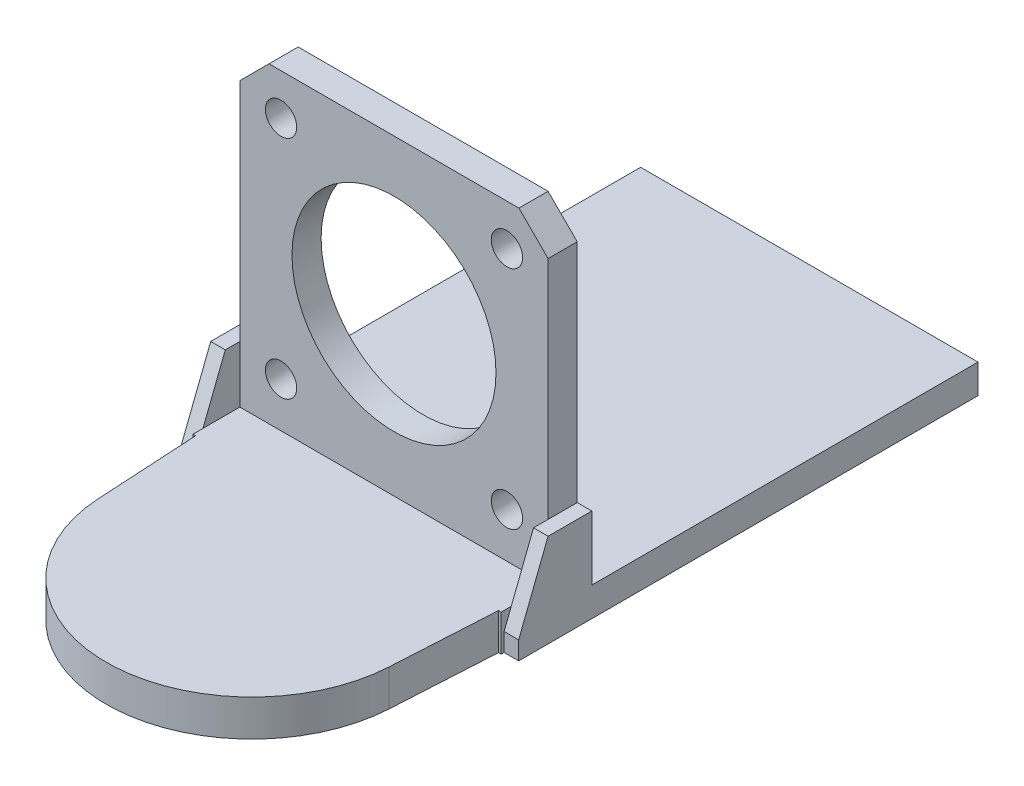
from build123d import *

# Parameters (mm, degrees)
SKETCH_5_W                = 42.3
SKETCH_5_H                = 50.3
SKETCH_5_R                = 11.15
SKETCH_5_R_2              = 2.15
EXTRUDE_2_DEPTH           = 4
EXTRUDE_3_DEPTH           = 4
SKETCH_7_R                = 1.7
CUT_EXTRUDE_3_DEPTH       = 4
CHAMFER_1_SIZE            = 4
EXTRUDE_4_DEPTH           = 2
EXTRUDE_5_REACH           = 79.8
EXTRUDE_6_REACH           = 80.956
SKETCH_12_W               = 46.3
SKETCH_12_H               = 3
EXTRUDE_7_DEPTH           = 53
EXTRUDE_9_DEPTH           = 4
CUT_EXTRUDE_4_DEPTH       = 5
SKETCH_17_R               = 5.175
EXTRUDE_10_DEPTH          = 15
SKETCH_18_R               = 1.6
CUT_EXTRUDE_6_DEPTH       = 15
F_2_0MM_1_D               = 3.1
F_2_0MM_1_DEPTH           = 4.45
F_2_0MM_1_TIP             = 1.55
F_2_0MM_1_ON_FACE_2_D     = 3.1
F_2_0MM_1_ON_FACE_2_DEPTH = 4.45
F_2_0MM_1_ON_FACE_2_TIP   = 1.55
F_2_0MM_1_ON_FACE_3_D     = 3.1
F_2_0MM_1_ON_FACE_3_DEPTH = 4.45
F_2_0MM_1_ON_FACE_3_TIP   = 1.55
SKETCH_21_W               = 46.3
SKETCH_21_H               = 53
CUT_EXTRUDE_7_DEPTH       = 1.5
CUT_EXTRUDE_START         = -0.5
CUT_EXTRUDE_8_DEPTH       = 0.5
EXTRUDE_START             = 2.5
EXTRUDE_11_DEPTH          = 2.5
SKETCH_25_R               = 2.55
CUT_EXTRUDE_9_DEPTH       = 15
SKETCH_28_R               = 5.175
EXTRUDE_13_DEPTH          = 3.5
EXTRUDE_START_2           = -17
SKETCH_30_R               = 5.175
EXTRUDE_15_DEPTH          = 17
SKETCH_31_R               = 8.175
EXTRUDE_16_DEPTH          = 13
SKETCH_32_R               = 2.5
CUT_EXTRUDE_10_DEPTH      = 18
CUT_EXTRUDE_START_2       = -1.5
SKETCH_33_R               = 8.175
CUT_EXTRUDE_11_DEPTH      = 1.5
F_3_0MM_1_D               = 3
F_3_0MM_1_DEPTH           = 5.5
F_3_0MM_1_TIP             = 1.5
F_3_0MM_1_ON_FACE_2_D     = 3
F_3_0MM_1_ON_FACE_2_DEPTH = 5.5
F_3_0MM_1_ON_FACE_2_TIP   = 1.5
F_3_0MM_1_ON_FACE_3_D     = 3
F_3_0MM_1_ON_FACE_3_DEPTH = 5.5
F_3_0MM_1_ON_FACE_3_TIP   = 1.5
SKETCH_36_R               = 14
CUT_EXTRUDE_12_DEPTH      = 5


with BuildPart() as part:
    # 草图5 → 凸台-拉伸2 (new body)
    with BuildSketch(Plane.XY):
        with Locations((0, 25.15)):
            Rectangle(SKETCH_5_W, SKETCH_5_H)
        with Locations((0, 29.15)):
            Circle(SKETCH_5_R, mode=Mode.SUBTRACT)
        with Locations((15.5, 44.65)):
            Circle(SKETCH_5_R_2, mode=Mode.SUBTRACT)
        with Locations((15.5, 13.65)):
            Circle(SKETCH_5_R_2, mode=Mode.SUBTRACT)
        with Locations((-15.5, 13.65)):
            Circle(SKETCH_5_R_2, mode=Mode.SUBTRACT)
        with Locations((-15.5, 44.65)):
            Circle(SKETCH_5_R_2, mode=Mode.SUBTRACT)
    extrude(amount=-EXTRUDE_2_DEPTH)

    # 草图6 → 凸台-拉伸3 (add)
    with BuildSketch(Plane.XZ):
        with BuildLine():
            Line((-21.15, 0), (-19.967256346, 20.643972909))
            ThreePointArc((-19.967256346, 20.643972909), (0, 39.5), (19.967256346, 20.643972909))
            Line((19.967256346, 20.643972909), (21.15, 0))
            Line((21.15, 0), (-21.15, 0))
        make_face()
    extrude(amount=-EXTRUDE_3_DEPTH)

    # 草图7 → 切除-拉伸3 (cut)
    with BuildSketch(Plane(origin=(0, 4, 0), x_dir=(1, 0, 0), z_dir=(0, 1, 0))):
        with Locations((0, -5.5)):
            Circle(SKETCH_7_R)
        with Locations((12.124355653, -12.5)):
            Circle(SKETCH_7_R)
        with Locations((12.124355653, -26.5)):
            Circle(SKETCH_7_R)
        with Locations((0, -33.5)):
            Circle(SKETCH_7_R)
        with Locations((-12.124355653, -26.5)):
            Circle(SKETCH_7_R)
        with Locations((-12.124355653, -12.5)):
            Circle(SKETCH_7_R)
    extrude(amount=-CUT_EXTRUDE_3_DEPTH, mode=Mode.SUBTRACT)

    # 倒角1
    chamfer_1_edges = [part.edges().sort_by_distance(p)[0] for p in [
        (21.15, 50.3, -2),
        (-21.15, 50.3, -2),
    ]]
    chamfer(chamfer_1_edges, length=CHAMFER_1_SIZE)

    # 草图9 → 凸台-拉伸4 (add)
    with BuildSketch(Plane.ZY.offset(21.15)):
        Polygon((-4, 0), (8, 0), (2, 15.3), (-4, 15.3), align=None)
    extrude_4 = extrude(amount=EXTRUDE_4_DEPTH)

    # 凸台-拉伸5: up to this plane
    extrude_5_end = Plane(origin=(-21.15, 4, 0), z_dir=(-0.9983628172970396, 0, 0.05719864542730192))
    # 草图10 → 凸台-拉伸5 (add, up to the surface)
    with BuildSketch(Plane.ZY.offset(23.15), mode=Mode.PRIVATE) as extrude_5_sk1:
        Polygon((-4, 0), (8, 0), (6.431372549, 4), (-4, 4), align=None)
    extrude_5_tool1 = split(extrude(extrude_5_sk1.sketch, amount=-EXTRUDE_5_REACH, mode=Mode.PRIVATE), bisect_by=extrude_5_end, keep=Keep.BOTH, mode=Mode.PRIVATE)
    add(extrude_5_tool1.solids().sort_by_distance((-23.15, 1.95338, 1.616984))[0])

    # 镜向2: 凸台-拉伸4 across plane
    add(extrude_4.mirror(Plane(origin=(0, 0, 0), x_dir=(0, 0, 1), z_dir=(1, 0, 0))))

    # 凸台-拉伸6: up to this plane
    extrude_6_end = Plane(origin=(21.15, 4, 0), z_dir=(0.9983628172970396, 0, 0.05719864542730192))
    # 草图11 → 凸台-拉伸6 (add, up to the surface)
    with BuildSketch(Plane(origin=(23.15, 0, 0), x_dir=(0, 0, -1), z_dir=(1, 0, 0)), mode=Mode.PRIVATE) as extrude_6_sk1:
        Polygon((-6.431372549, 4), (4, 4), (4, 0), (-8, 0), align=None)
    extrude_6_tool1 = split(extrude(extrude_6_sk1.sketch, amount=-EXTRUDE_6_REACH, mode=Mode.PRIVATE), bisect_by=extrude_6_end, keep=Keep.BOTH, mode=Mode.PRIVATE)
    add(extrude_6_tool1.solids().sort_by_distance((23.15, 1.95338, 1.616984))[0])

    # 草图12 → 凸台-拉伸7 (add)
    with BuildSketch(Plane(origin=(0, 0, -4), x_dir=(-1, 0, 0), z_dir=(0, 0, -1))):
        with Locations((0, 6.5)):
            Rectangle(SKETCH_12_W, SKETCH_12_H)
    extrude(amount=EXTRUDE_7_DEPTH)

    # 草图14 → 凸台-拉伸9 (add)
    with BuildSketch(Plane(origin=(0, 4, 0), x_dir=(1, 0, 0), z_dir=(0, 1, 0))):
        with BuildLine():
            Line((21.15, 0), (-21.15, 0))
            Line((-21.15, 0), (-21.15, -6.431372549))
            Line((-21.15, -6.431372549), (-20.781530951, -6.431372549))
            Line((-20.781530951, -6.431372549), (-19.967256346, -20.643972909))
            ThreePointArc((-19.967256346, -20.643972909), (0, -39.5), (19.967256346, -20.643972909))
            Line((19.967256346, -20.643972909), (20.781530951, -6.431372549))
            Line((20.781530951, -6.431372549), (21.15, -6.431372549))
            Line((21.15, -6.431372549), (21.15, 0))
        make_face()
    extrude(amount=EXTRUDE_9_DEPTH)

    # 草图15 → 切除-拉伸4 (cut)
    with BuildSketch(Plane.XZ):
        with BuildLine():
            Line((-23.15, -4), (23.15, -4))
            Line((23.15, -4), (23.15, 8))
            Line((23.15, 8), (20.691660451, 8))
            Line((20.691660451, 8), (19.967256346, 20.643972909))
            ThreePointArc((19.967256346, 20.643972909), (0, 39.5), (-19.967256346, 20.643972909))
            Line((-19.967256346, 20.643972909), (-20.691660451, 8))
            Line((-20.691660451, 8), (-23.15, 8))
            Line((-23.15, 8), (-23.15, -4))
        make_face()
    extrude(amount=-CUT_EXTRUDE_4_DEPTH, mode=Mode.SUBTRACT)

    # 草图17 → 凸台-拉伸10 (add)
    with BuildSketch(Plane(origin=(0, 8, 0), x_dir=(1, 0, 0), z_dir=(0, 1, 0))):
        with Locations((0, 16.5)):
            Circle(SKETCH_17_R)
    extrude(amount=-EXTRUDE_10_DEPTH)

    # 草图18 → 切除-拉伸6 (cut)
    with BuildSketch(Plane.XZ.offset(7)):
        with Locations((0, -16.5)):
            Circle(SKETCH_18_R)
    extrude(amount=-CUT_EXTRUDE_6_DEPTH, mode=Mode.SUBTRACT)

    # Ø2.0mm 暗销孔1
    with Locations(Plane(origin=(-2.383959963, -1.470142013, -11.906813753), x_dir=(0.887572221549, 0, 0.46066859187), z_dir=(-0.46066859187, 0, 0.887572221549))):
        with Locations((0, 0)):
            Hole(F_2_0MM_1_D / 2, depth=F_2_0MM_1_DEPTH)
            with Locations((0, 0, -(F_2_0MM_1_DEPTH + F_2_0MM_1_TIP / 2))):  # 90° drill point
                Cone(0, F_2_0MM_1_D / 2, F_2_0MM_1_TIP, mode=Mode.SUBTRACT)

    # Ø2.0mm 暗销孔1 on face 2
    with Locations(Plane(origin=(-4.001379199, -1.359919587, -19.781705274), x_dir=(0.634146160856, 0, -0.773213196131), z_dir=(-0.773213196131, 0, -0.634146160856))):
        with Locations((-1e-09, 0)):
            Hole(F_2_0MM_1_ON_FACE_2_D / 2, depth=F_2_0MM_1_ON_FACE_2_DEPTH)
            with Locations((0, 0, -(F_2_0MM_1_ON_FACE_2_DEPTH + F_2_0MM_1_ON_FACE_2_TIP / 2))):  # 90° drill point
                Cone(0, F_2_0MM_1_ON_FACE_2_D / 2, F_2_0MM_1_ON_FACE_2_TIP, mode=Mode.SUBTRACT)

    # Ø2.0mm 暗销孔1 on face 3
    with Locations(Plane(origin=(4.74207792, -1.268589172, -18.572033301), x_dir=(0.40039282367, 0, 0.916343596449), z_dir=(0.916343596449, 0, -0.40039282367))):
        with Locations((0, 0)):
            Hole(F_2_0MM_1_ON_FACE_3_D / 2, depth=F_2_0MM_1_ON_FACE_3_DEPTH)
            with Locations((0, 0, -(F_2_0MM_1_ON_FACE_3_DEPTH + F_2_0MM_1_ON_FACE_3_TIP / 2))):  # 90° drill point
                Cone(0, F_2_0MM_1_ON_FACE_3_D / 2, F_2_0MM_1_ON_FACE_3_TIP, mode=Mode.SUBTRACT)

    # 草图21 → 切除-拉伸7 (cut)
    with BuildSketch(Plane(origin=(0, 8, 0), x_dir=(1, 0, 0), z_dir=(0, 1, 0))):
        with Locations((0, 30.5)):
            Rectangle(SKETCH_21_W, SKETCH_21_H)
    extrude(amount=-CUT_EXTRUDE_7_DEPTH, mode=Mode.SUBTRACT)

    # 草图22 → 切除-拉伸8 (cut)
    with BuildSketch(Plane(origin=(0, 8, 0), x_dir=(1, 0, 0), z_dir=(0, 1, 0)).offset(CUT_EXTRUDE_START)):
        with BuildLine():
            Line((21.15, -6.431372549), (21.15, -4.862745098))
            Line((21.15, -4.862745098), (21.15, 0))
            Line((21.15, 0), (-21.15, 0))
            Line((-21.15, 0), (-21.15, -4.862745098))
            Line((-21.15, -4.862745098), (-21.15, -6.431372549))
            Line((-21.15, -6.431372549), (-20.781530951, -6.431372549))
            Line((-20.781530951, -6.431372549), (-19.967256346, -20.643972909))
            ThreePointArc((-19.967256346, -20.643972909), (0, -39.5), (19.967256346, -20.643972909))
            Line((19.967256346, -20.643972909), (20.781530951, -6.431372549))
            Line((20.781530951, -6.431372549), (21.15, -6.431372549))
        make_face()
    extrude(amount=CUT_EXTRUDE_8_DEPTH, mode=Mode.SUBTRACT)

    # 草图23 → 凸台-拉伸11 (add)
    with BuildSketch(Plane.XZ.offset(-5).offset(EXTRUDE_START)):
        with BuildLine():
            Line((23.15, -57), (23.15, 6.039215686))
            Line((23.15, 6.039215686), (21.15, 6.039215686))
            Line((21.15, 6.039215686), (21.15, 6.431372549))
            Line((21.15, 6.431372549), (20.781530951, 6.431372549))
            Line((20.781530951, 6.431372549), (19.967256346, 20.643972909))
            ThreePointArc((19.967256346, 20.643972909), (0, 39.5), (-19.967256346, 20.643972909))
            Line((-19.967256346, 20.643972909), (-20.781530951, 6.431372549))
            Line((-20.781530951, 6.431372549), (-21.15, 6.431372549))
            Line((-21.15, 6.431372549), (-21.15, 6.039215686))
            Line((-21.15, 6.039215686), (-23.15, 6.039215686))
            Line((-23.15, 6.039215686), (-23.15, -57))
            Line((-23.15, -57), (23.15, -57))
        make_face()
    extrude(amount=-EXTRUDE_11_DEPTH)

    # 草图25 → 切除-拉伸9 (cut)
    with BuildSketch(Plane.XZ.offset(7)):
        with Locations((0, -16.5)):
            Circle(SKETCH_25_R)
    extrude(amount=-CUT_EXTRUDE_9_DEPTH, mode=Mode.SUBTRACT)

    # 草图28 → 凸台-拉伸13 (add)
    with BuildSketch(Plane.XZ.offset(7)):
        with Locations((0, -16.5)):
            Circle(SKETCH_28_R)
    extrude(amount=EXTRUDE_13_DEPTH)

    # 草图30 → 凸台-拉伸15 (add)
    with BuildSketch(Plane.XZ.offset(10.5).offset(EXTRUDE_START_2)):
        with Locations((0, -16.5)):
            Circle(SKETCH_30_R)
    extrude(amount=EXTRUDE_15_DEPTH)

    # 草图31 → 凸台-拉伸16 (add)
    with BuildSketch(Plane.XZ.offset(-2.5)):
        with Locations((0, -16.5)):
            Circle(SKETCH_31_R)
    extrude(amount=EXTRUDE_16_DEPTH)

    # 草图32 → 切除-拉伸10 (cut)
    with BuildSketch(Plane.XZ.offset(10.5)):
        with Locations((0, -16.5)):
            Circle(SKETCH_32_R)
    extrude(amount=-CUT_EXTRUDE_10_DEPTH, mode=Mode.SUBTRACT)

    # 草图33 → 切除-拉伸11 (cut)
    with BuildSketch(Plane.XZ.offset(10.5).offset(CUT_EXTRUDE_START_2)):
        with Locations((0, -16.5)):
            Circle(SKETCH_33_R)
    extrude(amount=CUT_EXTRUDE_11_DEPTH, mode=Mode.SUBTRACT)

    # Ø3.0mm 暗销孔1
    with Locations(Plane(origin=(-4.630535501, -3.632499102, -9.762881479), x_dir=(0.824112357357, 0, 0.566426361014), z_dir=(-0.566426361014, 0, 0.824112357357))):
        with Locations((0, 0)):
            Hole(F_3_0MM_1_D / 2, depth=F_3_0MM_1_DEPTH)
            with Locations((0, 0, -(F_3_0MM_1_DEPTH + F_3_0MM_1_TIP / 2))):  # 90° drill point
                Cone(0, F_3_0MM_1_D / 2, F_3_0MM_1_TIP, mode=Mode.SUBTRACT)

    # Ø3.0mm 暗销孔1 on face 2
    with Locations(Plane(origin=(-3.963100189, -2.963132752, -23.650137194), x_dir=(-0.874634588785, 0, 0.484782772076), z_dir=(-0.484782772076, 0, -0.874634588785))):
        with Locations((0, 0)):
            Hole(F_3_0MM_1_ON_FACE_2_D / 2, depth=F_3_0MM_1_ON_FACE_2_DEPTH)
            with Locations((0, 0, -(F_3_0MM_1_ON_FACE_2_DEPTH + F_3_0MM_1_ON_FACE_2_TIP / 2))):  # 90° drill point
                Cone(0, F_3_0MM_1_ON_FACE_2_D / 2, F_3_0MM_1_ON_FACE_2_TIP, mode=Mode.SUBTRACT)

    # Ø3.0mm 暗销孔1 on face 3
    with Locations(Plane(origin=(7.209647411, -3.975215155, -12.646221437), x_dir=(-0.471410072716, 0, 0.881914136037), z_dir=(0.881914136037, 0, 0.471410072716))):
        with Locations((0, 0)):
            Hole(F_3_0MM_1_ON_FACE_3_D / 2, depth=F_3_0MM_1_ON_FACE_3_DEPTH)
            with Locations((0, 0, -(F_3_0MM_1_ON_FACE_3_DEPTH + F_3_0MM_1_ON_FACE_3_TIP / 2))):  # 90° drill point
                Cone(0, F_3_0MM_1_ON_FACE_3_D / 2, F_3_0MM_1_ON_FACE_3_TIP, mode=Mode.SUBTRACT)

    # 草图36 → 切除-拉伸12 (cut)
    with BuildSketch(Plane(origin=(0, 0, -4), x_dir=(-1, 0, 0), z_dir=(0, 0, -1))):
        with Locations((0, 29.15)):
            Circle(SKETCH_36_R)
    extrude(amount=-CUT_EXTRUDE_12_DEPTH, mode=Mode.SUBTRACT)


solid = part.part
